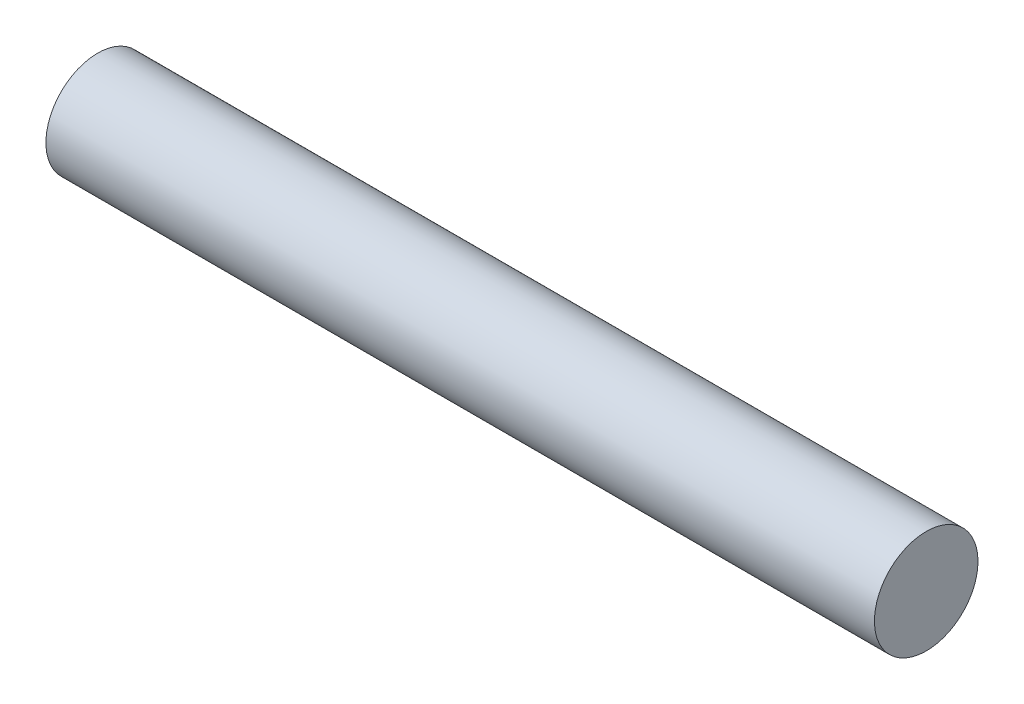
from build123d import *

# Parameters (mm, degrees)
SKETCH1_R           = 3.175
BOSS_EXTRUDE1_DEPTH = 50.8


with BuildPart() as part:
    # Sketch1 → Boss-Extrude1 (new body)
    with BuildSketch(Plane(origin=(0, 0, 0), x_dir=(0, 0, -1), z_dir=(1, 0, 0))):
        Circle(SKETCH1_R)
    extrude(amount=BOSS_EXTRUDE1_DEPTH)


solid = part.part
